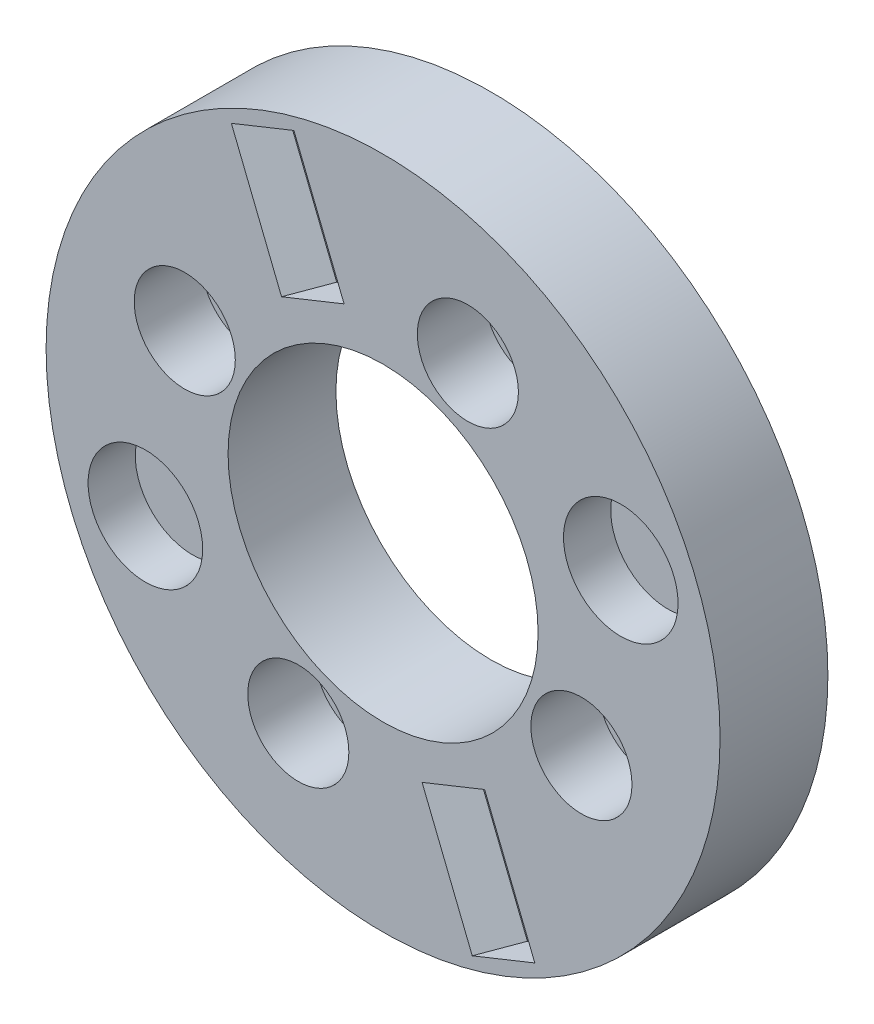
from build123d import *

# Parameters (mm, degrees)
ESQUISSE1_R             = 25
ESQUISSE1_R_2           = 11.5
BOSS_EXTRU_1_DEPTH      = 8
ESQUISSE2_R             = 2.5
ENL_V_MAT_EXTRU_1_DEPTH = 37.249137921
ESQUISSE4_R             = 3.75
ENL_V_MAT_EXTRU_2_DEPTH = 5
ENL_V_START             = -14
ENL_V_MAT_EXTRU_7_DEPTH = 10
ESQUISSE10_R            = 4.25
ENL_V_MAT_EXTRU_5_DEPTH = 3.5
ESQUISSE12_R            = 4.25
ENL_V_MAT_EXTRU_6_DEPTH = 3.5


with BuildPart() as part:
    # Esquisse1 → Boss.-Extru.1 (new body)
    with BuildSketch(Plane.XY):
        Circle(ESQUISSE1_R)
        Circle(ESQUISSE1_R_2, mode=Mode.SUBTRACT)
    extrude(amount=BOSS_EXTRU_1_DEPTH)

    # Esquisse2 → Enlèv. mat.-Extru.1 (cut, through all)
    with BuildSketch(Plane.XY.offset(8)):
        with Locations((-14.713385832, 6.286197369)):
            Circle(ESQUISSE2_R)
        with Locations((6.28955657, 14.711950182)):
            Circle(ESQUISSE2_R)
        with Locations((14.713385832, -6.286197369)):
            Circle(ESQUISSE2_R)
        with Locations((-6.28955657, -14.711950182)):
            Circle(ESQUISSE2_R)
    extrude(amount=-ENL_V_MAT_EXTRU_1_DEPTH, mode=Mode.SUBTRACT)

    # Esquisse4 → Enlèv. mat.-Extru.2 (cut)
    with BuildSketch(Plane.XY.offset(8)):
        with Locations((-6.28955657, -14.711950182)):
            Circle(ESQUISSE4_R)
        with Locations((14.713385832, -6.286197369)):
            Circle(ESQUISSE4_R)
        with Locations((6.28955657, 14.711950182)):
            Circle(ESQUISSE4_R)
        with Locations((-14.713385832, 6.286197369)):
            Circle(ESQUISSE4_R)
    extrude(amount=-ENL_V_MAT_EXTRU_2_DEPTH, mode=Mode.SUBTRACT)

    # Esquisse13 → Enlèv. mat.-Extru.7 (cut)
    with BuildSketch(Plane(origin=(0, 0, 0), x_dir=(-0.9281017411356184, -0.3723266819622707, 0), z_dir=(-0.3723266819622707, 0.9281017411356184, 0)).offset(ENL_V_START)):
        Polygon((-2.5, 8), (2.5, 8), (0.5, 5.763932023), (-0.5, 5.763932023), align=None)
    enl_v_mat_extru_7 = extrude(amount=-ENL_V_MAT_EXTRU_7_DEPTH, mode=Mode.SUBTRACT)

    # Esquisse10 → Enlèv. mat.-Extru.5 (cut)
    with BuildSketch(Plane(origin=(0, 0, 0), x_dir=(-1, 0, 0), z_dir=(0, 0, -1))):
        with Locations((7.074206957, 17.633933082)):
            Circle(ESQUISSE10_R)
        with Locations((-7.074206957, -17.633933082)):
            Circle(ESQUISSE10_R)
    extrude(amount=-ENL_V_MAT_EXTRU_5_DEPTH, mode=Mode.SUBTRACT)

    # Esquisse12 → Enlèv. mat.-Extru.6 (cut)
    with BuildSketch(Plane.XY.offset(8)):
        with Locations((17.633933082, 7.074206957)):
            Circle(ESQUISSE12_R)
        with Locations((-17.633933082, -7.074206957)):
            Circle(ESQUISSE12_R)
    extrude(amount=-ENL_V_MAT_EXTRU_6_DEPTH, mode=Mode.SUBTRACT)

    # Symétrie1: Enlèv. mat.-Extru.7 across plane
    add(enl_v_mat_extru_7.mirror(Plane(origin=(0, 0, 0), x_dir=(0, 0, 1), z_dir=(-0.3723266819622707, 0.9281017411356184, 0))), mode=Mode.SUBTRACT)


solid = part.part
